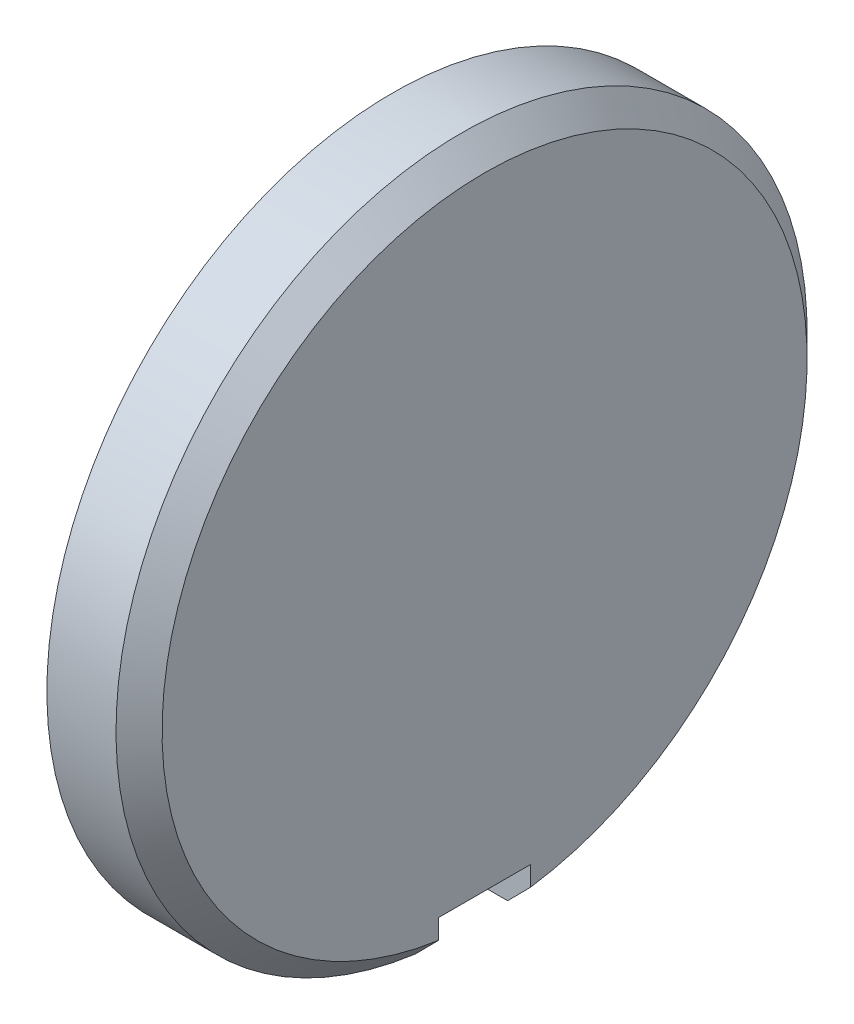
from build123d import *

# Parameters (mm, degrees)
BOSS_EXTRUDE1_START = -55.2
SKETCH2_W           = 1.28
SKETCH2_H           = 0.8
BOSS_EXTRUDE1_DEPTH = 6.4
BOSS_EXTRUDE2_START = -52.4
SKETCH3_W           = 1.28
SKETCH3_H           = 6.4
BOSS_EXTRUDE2_DEPTH = 0.8
BOSS_EXTRUDE3_START = -52.8
SKETCH4_W           = 1.8
SKETCH4_H           = 0.9
BOSS_EXTRUDE3_DEPTH = 1.6


with BuildPart() as part:
    # Sketch1 → Revolve1 (revolve)
    with BuildSketch(Plane.XY.offset(-52), mode=Mode.PRIVATE) as revolve1_sk:
        Polygon((58.2, 20.3), (59.4, 20.3), (59.4, 18), (61, 18), (61, 23.6), (60.6, 24), (59.4, 24), (59.4, 21), (58.2, 21), align=None)
    revolve(revolve1_sk.sketch.rotate(Axis((53.2, 18, -52), (1, 0, 0)), 90), axis=Axis((53.2, 18, -52), (1, 0, 0)))


with BuildPart() as body_2:
    # Sketch2 → Boss-Extrude1 (new body)
    with BuildSketch(Plane.XY.offset(BOSS_EXTRUDE1_START)):
        with Locations((58.74, 18)):
            Rectangle(SKETCH2_W, SKETCH2_H)
    extrude(amount=BOSS_EXTRUDE1_DEPTH)


with BuildPart() as part_1:
    add(part.part)

    # Combine1: cut body 2
    add(body_2.part, mode=Mode.SUBTRACT)


with BuildPart() as body_2_2:
    # Sketch3 → Boss-Extrude2 (new body)
    with BuildSketch(Plane.XY.offset(BOSS_EXTRUDE2_START)):
        with Locations((58.74, 18)):
            Rectangle(SKETCH3_W, SKETCH3_H)
    extrude(amount=BOSS_EXTRUDE2_DEPTH)


with BuildPart() as part_2:
    add(part_1.part)

    # Combine2: cut body 2 2
    add(body_2_2.part, mode=Mode.SUBTRACT)


with BuildPart() as body_2_3:
    # Sketch4 → Boss-Extrude3 (new body)
    with BuildSketch(Plane.XY.offset(BOSS_EXTRUDE3_START)):
        with Locations((60.2, 12.35)):
            Rectangle(SKETCH4_W, SKETCH4_H)
    extrude(amount=BOSS_EXTRUDE3_DEPTH)


with BuildPart() as part_3:
    add(part_2.part)

    # Combine3: cut body 2 3
    add(body_2_3.part, mode=Mode.SUBTRACT)


solid = part_3.part
